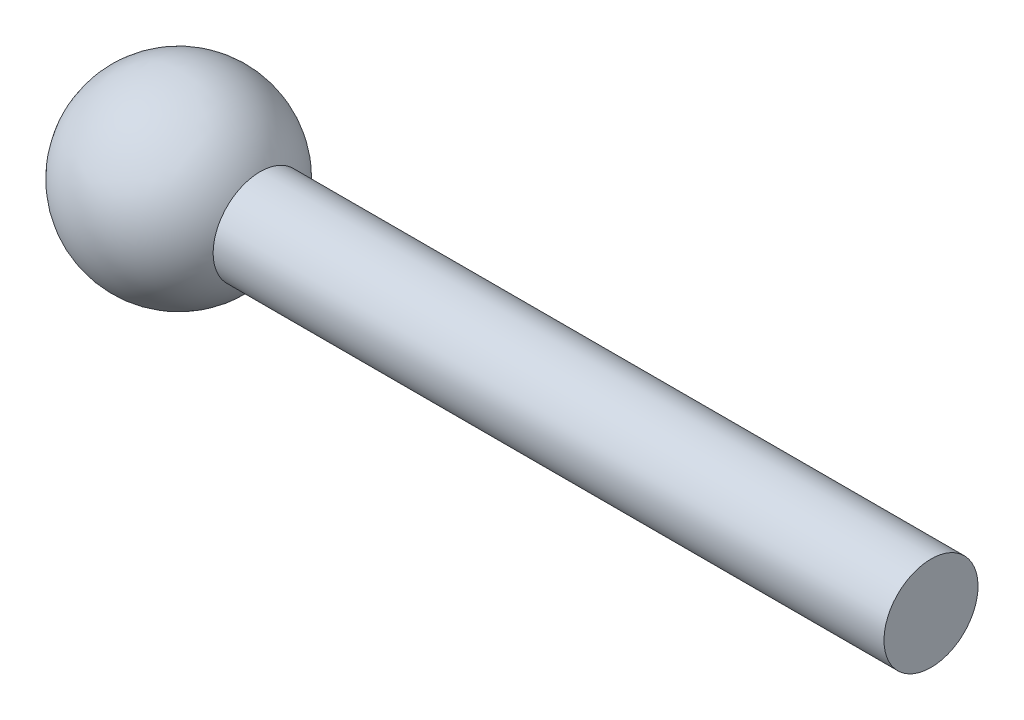
from build123d import *


with BuildPart() as part:
    # Sketch1 → Revolve1 (revolve)
    with BuildSketch(Plane.XY, mode=Mode.PRIVATE) as revolve1_sk:
        with BuildLine():
            Line((0, 0), (-45.300738686, 0))
            ThreePointArc((-45.300738686, 0), (-52.443500936, 2.958628997), (-57.15, -3.175))
            Line((-57.15, -3.175), (0, -3.175))
            Line((0, -3.175), (0, 0))
        make_face()
    revolve(revolve1_sk.sketch.rotate(Axis((-57.15, -3.175, 0), (1, 0, 0)), 180), axis=Axis((-57.15, -3.175, 0), (1, 0, 0)))


solid = part.part
